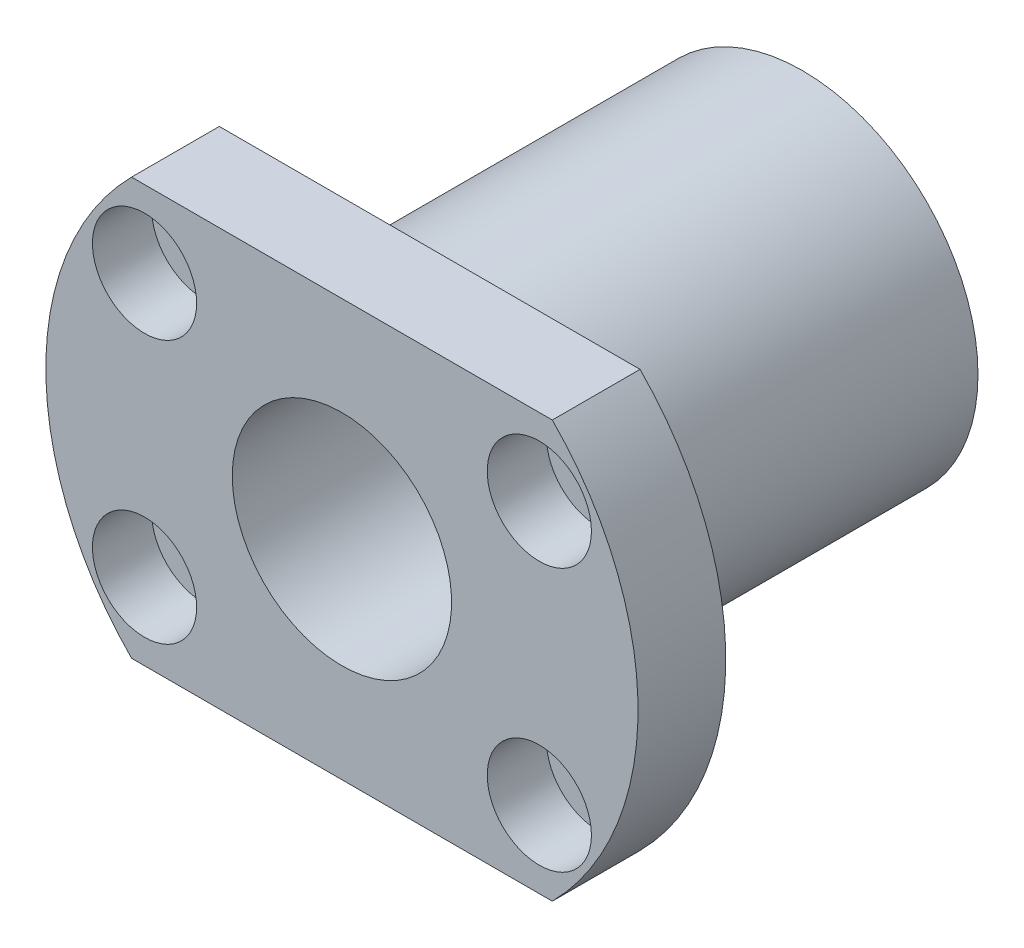
from build123d import *

# Parameters (mm, degrees)
SKETCH_2_OUTSIDE_W        = 73.432
SKETCH_2_OUTSIDE_H        = 73.432
SKETCH_2_OUTSIDE_W_2      = 54
SKETCH_2_OUTSIDE_H_2      = 38
CUT_EXTRUDE_1_DEPTH       = 8
HOLE_WIZARD_1_D           = 5.5
HOLE_WIZARD_1_DEPTH       = 8
HOLE_WIZARD_1_CBORE_D     = 9.5
HOLE_WIZARD_1_CBORE_DEPTH = 5.4


with BuildPart() as part:
    # 草图1 → 旋转1 (revolve)
    with BuildSketch(Plane(origin=(0, 0, 0), x_dir=(0, 0, 1), z_dir=(0, -1, 0))):
        Polygon((0, 10), (42, 10), (42, 27), (34, 27), (34, 16), (0, 16), align=None)
    revolve(axis=Axis((0, 0, 0), (0, 0, 1)))

    # 草图2 outside → 切除-拉伸1 (cut)
    with BuildSketch(Plane.XY.offset(42)):
        Rectangle(SKETCH_2_OUTSIDE_W, SKETCH_2_OUTSIDE_H)
        Rectangle(SKETCH_2_OUTSIDE_W_2, SKETCH_2_OUTSIDE_H_2, mode=Mode.SUBTRACT)
    extrude(amount=-CUT_EXTRUDE_1_DEPTH, mode=Mode.SUBTRACT)

    # 孔1
    with Locations(Plane.XY.offset(42)):
        with Locations((-18, -12), (-18, 12), (18, 12), (18, -12), (0, 0)):
            CounterBoreHole(HOLE_WIZARD_1_D / 2, HOLE_WIZARD_1_CBORE_D / 2, HOLE_WIZARD_1_CBORE_DEPTH, depth=HOLE_WIZARD_1_DEPTH)


solid = part.part
